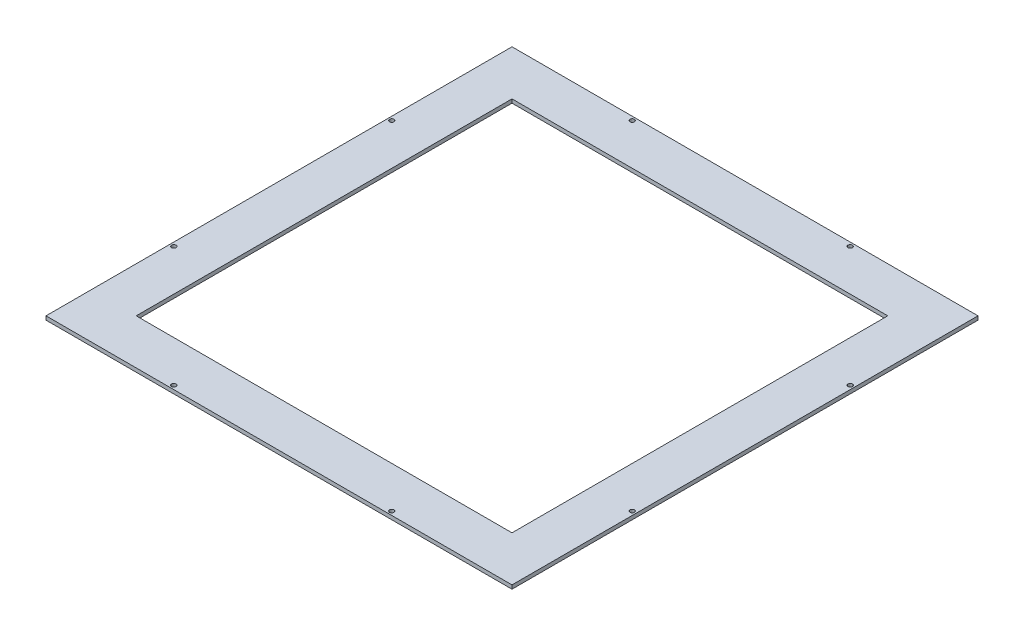
from build123d import *

# Parameters (mm, degrees)
SKETCH1_W           = 393.7
SKETCH1_H           = 393.7
BOSS_EXTRUDE1_DEPTH = 3.175
SKETCH2_W           = 317.5
SKETCH2_H           = 317.5
CUT_EXTRUDE1_DEPTH  = 279.40604452
SKETCH3_R           = 1.905
CUT_EXTRUDE3_DEPTH  = 279.40604452


with BuildPart() as part:
    # Sketch1 → Boss-Extrude1 (new body)
    with BuildSketch(Plane(origin=(0, 0, 0), x_dir=(1, 0, 0), z_dir=(0, 1, 0))):
        Rectangle(SKETCH1_W, SKETCH1_H)
    extrude(amount=BOSS_EXTRUDE1_DEPTH)

    # Sketch2 → Cut-Extrude1 (cut, through all)
    with BuildSketch(Plane(origin=(0, 3.175, 0), x_dir=(1, 0, 0), z_dir=(0, 1, 0))):
        Rectangle(SKETCH2_W, SKETCH2_H)
    extrude(amount=-CUT_EXTRUDE1_DEPTH, mode=Mode.SUBTRACT)

    # Sketch3 → Cut-Extrude3 (cut, through all)
    with BuildSketch(Plane(origin=(0, 3.175, 0), x_dir=(1, 0, 0), z_dir=(0, 1, 0))):
        with Locations(Location((-92.075, -193.675, 0), (0, 0, 270))):
            Circle(SKETCH3_R)
        with Locations(Location((92.075, -193.675, 0), (0, 0, 270))):
            Circle(SKETCH3_R)
        with Locations(Location((193.675, -92.075, 0), (0, 0, 270))):
            Circle(SKETCH3_R)
        with Locations(Location((193.675, 92.075, 0), (0, 0, 270))):
            Circle(SKETCH3_R)
        with Locations(Location((92.075, 193.675, 0), (0, 0, 270))):
            Circle(SKETCH3_R)
        with Locations(Location((-92.075, 193.675, 0), (0, 0, 270))):
            Circle(SKETCH3_R)
        with Locations(Location((-193.675, 92.075, 0), (0, 0, 270))):
            Circle(SKETCH3_R)
        with Locations(Location((-193.675, -92.075, 0), (0, 0, 270))):
            Circle(SKETCH3_R)
    extrude(amount=-CUT_EXTRUDE3_DEPTH, mode=Mode.SUBTRACT)


solid = part.part
